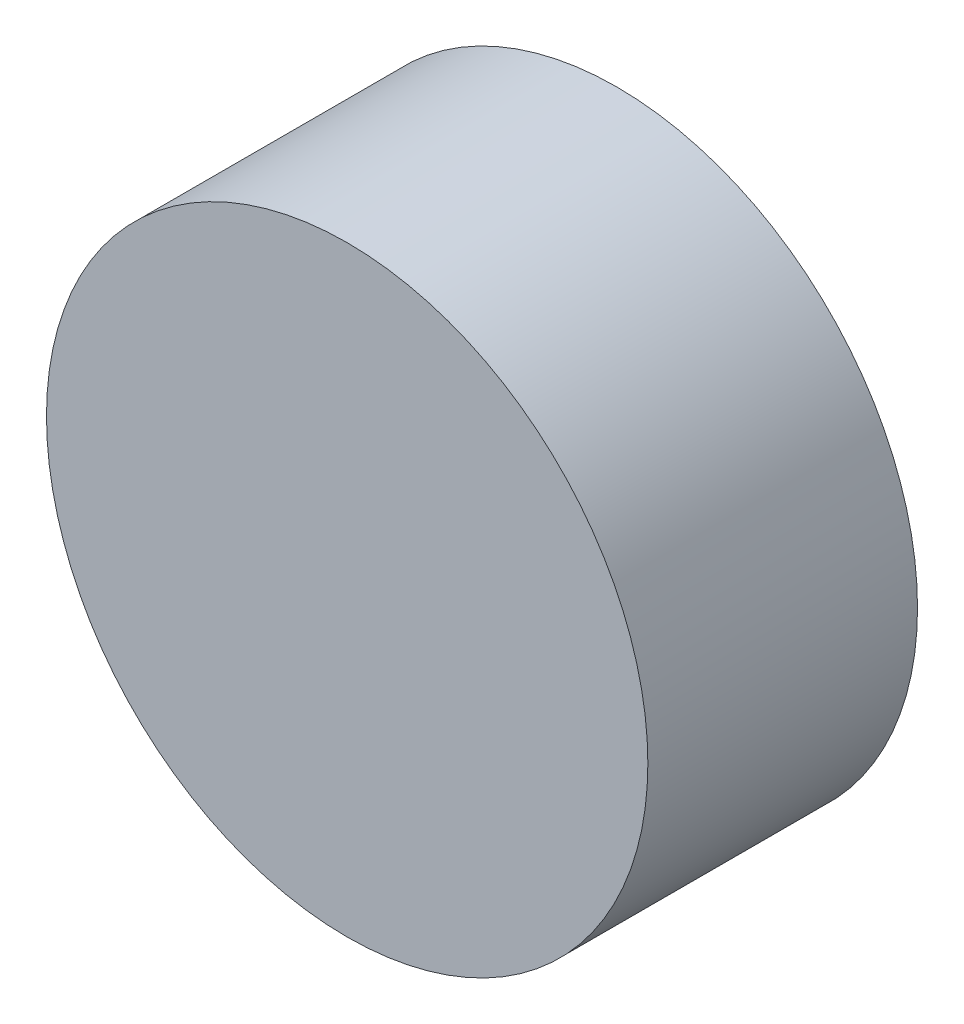
from build123d import *

# Parameters (mm, degrees)
ESBO_O1_R                = 228.6
RESSALTO_EXTRUS_O3_DEPTH = 205


with BuildPart() as part:
    # Esboço1 → Ressalto-extrusão3 (new body)
    with BuildSketch(Plane.XY):
        with Locations(Location((0, 0, 0), (0, 0, 180))):
            Circle(ESBO_O1_R)
    extrude(amount=RESSALTO_EXTRUS_O3_DEPTH)


solid = part.part
